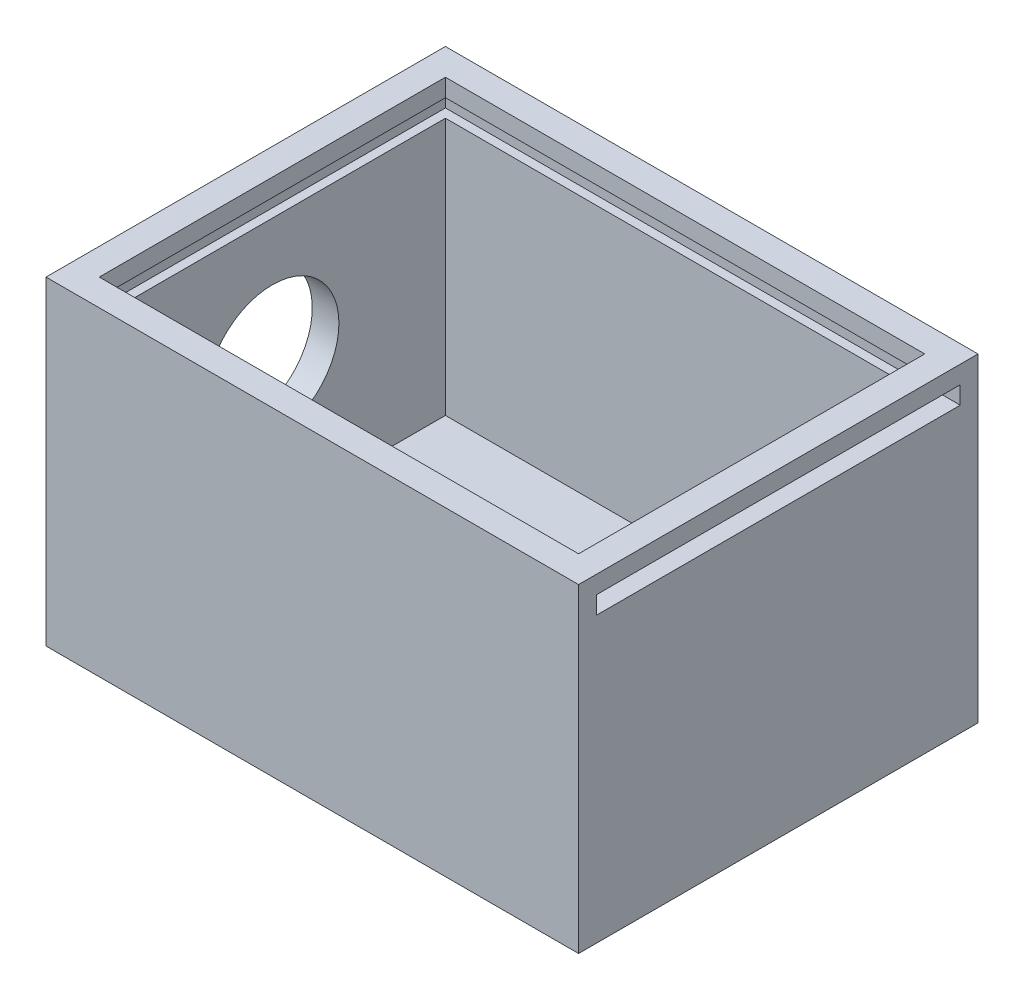
from build123d import *

# Parameters (mm, degrees)
SKETCH1_W           = 60
SKETCH1_H           = 36
BOSS_EXTRUDE1_DEPTH = 45
SHELL1_T            = -3
SKETCH2_W           = 41
SKETCH2_H           = 2
CUT_EXTRUDE1_DEPTH  = 58
SKETCH3_R           = 7.5
CUT_EXTRUDE2_DEPTH  = 48


with BuildPart() as part:
    # Sketch1 → Boss-Extrude1 (new body)
    with BuildSketch(Plane.XY):
        with Locations((30, -18)):
            Rectangle(SKETCH1_W, SKETCH1_H)
    extrude(amount=BOSS_EXTRUDE1_DEPTH)

    # Shell1
    shell1_openings = [part.faces().sort_by_distance(p)[0] for p in [
        (30, 0, 22.5),
    ]]
    offset(amount=SHELL1_T, openings=shell1_openings, kind=Kind.INTERSECTION)

    # Sketch2 → Cut-Extrude1 (cut)
    with BuildSketch(Plane(origin=(60, 0, 0), x_dir=(0, 0, -1), z_dir=(1, 0, 0))):
        with Locations((-22.5, -3)):
            Rectangle(SKETCH2_W, SKETCH2_H)
    extrude(amount=-CUT_EXTRUDE1_DEPTH, mode=Mode.SUBTRACT)

    # Sketch3 → Cut-Extrude2 (cut)
    with BuildSketch(Plane.ZY):
        with Locations(Location((22.5, -18, 0), (0, 0, 270))):
            Circle(SKETCH3_R)
    extrude(amount=-CUT_EXTRUDE2_DEPTH, mode=Mode.SUBTRACT)


solid = part.part
